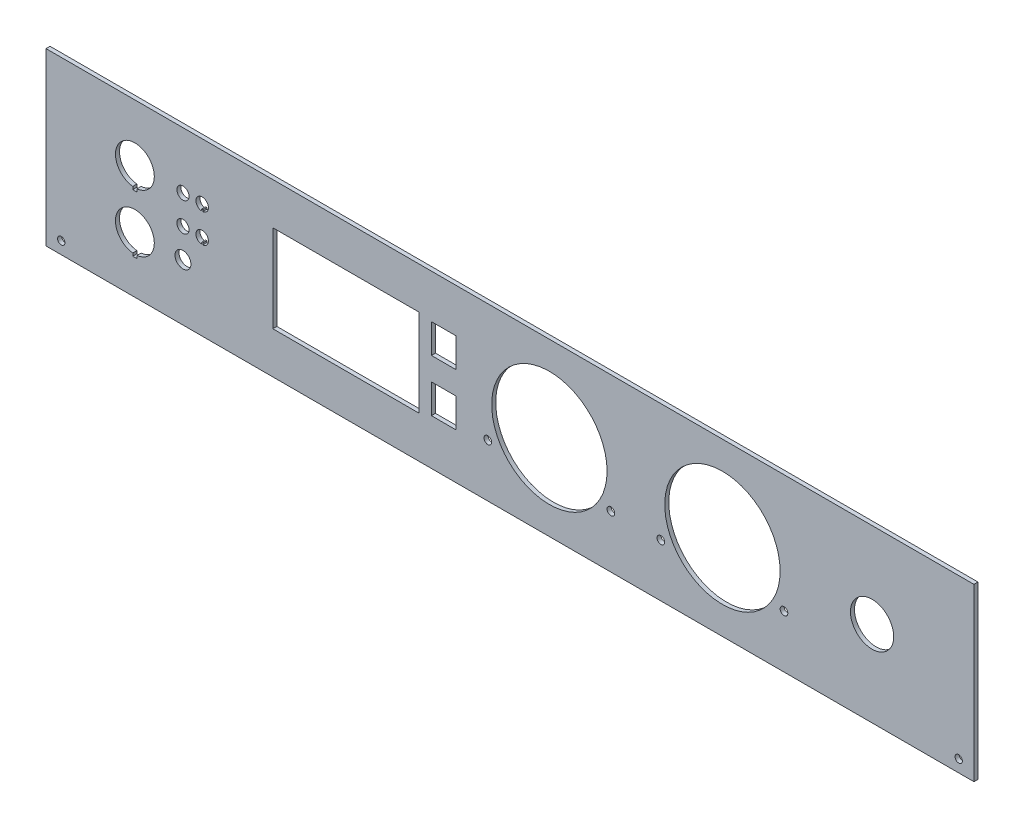
from build123d import *

# Parameters (mm, degrees)
SKETCH1_W              = 482.6
SKETCH1_H              = 88.9
FRONT_PANEL_DEPTH      = 2.1
MOUNTING_HOLES_REACH   = 252.351
SKETCH7_R              = 1.89865
START_STOP_DEPTH       = 251.351064757
SKETCH3_R              = 3.175
MODE_SELECT_DEPTH      = 251.351064757
SKETCH4_W              = 76
SKETCH4_H              = 45.5
LCD_CUTOUT_DEPTH       = 251.351064757
SKETCH5_R              = 11.25
E_STOP_CUTOUT_DEPTH    = 251.351064757
SKETCH6_W              = 12.7
SKETCH6_H              = 15.24
LCD_PUSHBUTTONS_DEPTH  = 251.351064757
ERROR_INDICATOR_REACH  = 252.351
SKETCH8_R              = 4.15
PANEL_METER_CUTOUT_R   = 30
PANEL_METER_CUTOUT_R_2 = 2
PANEL_METER_DEPTH      = 251.351064757
LPATTERN1_COUNT        = 2
LPATTERN1_PITCH        = 90


with BuildPart() as part:
    # Sketch1 → Front panel (new body)
    with BuildSketch(Plane.XY):
        with Locations((0, 22.225)):
            Rectangle(SKETCH1_W, SKETCH1_H)
    extrude(amount=FRONT_PANEL_DEPTH)

    # Sketch7 → Mounting holes (cut, up to next)
    with BuildSketch(Plane.XY.offset(2.1), mode=Mode.PRIVATE) as mounting_holes_sk1:
        with Locations((-233.3625, -15.875)):
            Circle(SKETCH7_R)
    mounting_holes_tool1 = extrude(mounting_holes_sk1.sketch, amount=-MOUNTING_HOLES_REACH, mode=Mode.PRIVATE) & part.part
    # Sketch7 → Mounting holes (cut, up to next)
    with BuildSketch(Plane.XY.offset(2.1), mode=Mode.PRIVATE) as mounting_holes_sk2:
        with Locations((233.3625, -15.875)):
            Circle(SKETCH7_R)
    mounting_holes_tool2 = extrude(mounting_holes_sk2.sketch, amount=-MOUNTING_HOLES_REACH, mode=Mode.PRIVATE) & part.part
    add(mounting_holes_tool1.solids().sort_by_distance((-233.3625, -15.875, 2.1))[0], mode=Mode.SUBTRACT)
    add(mounting_holes_tool2.solids().sort_by_distance((233.3625, -15.875, 2.1))[0], mode=Mode.SUBTRACT)

    # Sketch2 → Start/stop (cut, through all)
    with BuildSketch(Plane.XY.offset(2.1)):
        with BuildLine():
            Line((-196.175880429, 27.185079682), (-196.175880429, 25.725))
            Line((-196.175880429, 25.725), (-193.975880429, 25.725))
            Line((-193.975880429, 25.725), (-193.975880429, 27.185079682))
            ThreePointArc((-193.975880429, 27.185079682), (-195.075880429, 47.325), (-196.175880429, 27.185079682))
        make_face()
        with BuildLine():
            Line((-196.175880429, -2.814920318), (-196.175880429, -4.275))
            Line((-196.175880429, -4.275), (-193.975880429, -4.275))
            Line((-193.975880429, -4.275), (-193.975880429, -2.814920318))
            ThreePointArc((-193.975880429, -2.814920318), (-195.075880429, 17.325), (-196.175880429, -2.814920318))
        make_face()
    extrude(amount=-START_STOP_DEPTH, mode=Mode.SUBTRACT)

    # Sketch3 → Mode select (cut, through all)
    with BuildSketch(Plane.XY.offset(2.1)):
        with Locations((-170.075880429, 37.225)):
            Circle(SKETCH3_R)
        with Locations((-170.075880429, 22.225)):
            Circle(SKETCH3_R)
        with BuildLine():
            Line((-160.375880429, 33.988875775), (-160.375880429, 34.875))
            Line((-160.375880429, 34.875), (-159.775880429, 34.875))
            Line((-159.775880429, 34.875), (-159.775880429, 33.988875775))
            ThreePointArc((-159.775880429, 33.988875775), (-160.075880429, 40.475), (-160.375880429, 33.988875775))
        make_face()
        with BuildLine():
            Line((-160.375880429, 18.988875775), (-160.375880429, 19.875))
            Line((-160.375880429, 19.875), (-159.775880429, 19.875))
            Line((-159.775880429, 19.875), (-159.775880429, 18.988875775))
            ThreePointArc((-159.775880429, 18.988875775), (-160.075880429, 25.475), (-160.375880429, 18.988875775))
        make_face()
    extrude(amount=-MODE_SELECT_DEPTH, mode=Mode.SUBTRACT)

    # Sketch4 → LCD cutout (cut, through all)
    with BuildSketch(Plane.XY.offset(2.1)):
        with Locations((-85.340826022, 22.225)):
            Rectangle(SKETCH4_W, SKETCH4_H)
    extrude(amount=-LCD_CUTOUT_DEPTH, mode=Mode.SUBTRACT)

    # Sketch5 → E-stop cutout (cut, through all)
    with BuildSketch(Plane.XY.offset(2.1)):
        with Locations((188.308959836, 22.225)):
            Circle(SKETCH5_R)
    extrude(amount=-E_STOP_CUTOUT_DEPTH, mode=Mode.SUBTRACT)

    # Sketch6 → LCD pushbuttons (cut, through all)
    with BuildSketch(Plane.XY.offset(2.1)):
        with Locations((-34.530826022, 36.3075)):
            Rectangle(SKETCH6_W, SKETCH6_H)
        with Locations((-34.530826022, 9.19)):
            Rectangle(SKETCH6_W, SKETCH6_H)
    extrude(amount=-LCD_PUSHBUTTONS_DEPTH, mode=Mode.SUBTRACT)

    # Sketch8 → ERROR indicator (cut, up to next)
    with BuildSketch(Plane.XY.offset(2.1), mode=Mode.PRIVATE) as error_indicator_sk1:
        with Locations((-170.075880429, 7.225)):
            Circle(SKETCH8_R)
    error_indicator_tool1 = extrude(error_indicator_sk1.sketch, amount=-ERROR_INDICATOR_REACH, mode=Mode.PRIVATE) & part.part
    add(error_indicator_tool1.solids().sort_by_distance((-170.07588, 7.225, 2.1))[0], mode=Mode.SUBTRACT)

    # Panel meter cutout → Panel meter (cut, through all)
    with BuildSketch(Plane.XY.offset(2.1)):
        with Locations((20.488631919, 22.225)):
            Circle(PANEL_METER_CUTOUT_R)
        with Locations((52.488631919, 5.225)):
            Circle(PANEL_METER_CUTOUT_R_2)
        with Locations((-11.511368081, 5.225)):
            Circle(PANEL_METER_CUTOUT_R_2)
    panel_meter = extrude(amount=-PANEL_METER_DEPTH, mode=Mode.SUBTRACT)

    # LPattern1: Panel meter ×2
    with Locations(*[(i * LPATTERN1_PITCH, 0, 0) for i in range(1, LPATTERN1_COUNT)]):
        add(panel_meter, mode=Mode.SUBTRACT)


solid = part.part
